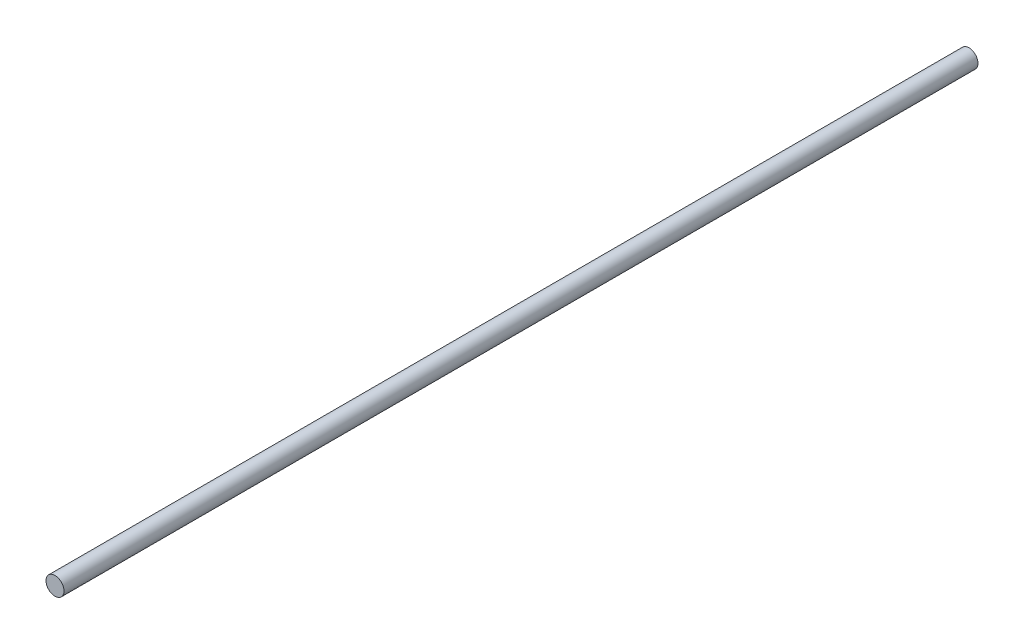
from build123d import *

# Parameters (mm, degrees)
SKETCH2_W = 405.8
SKETCH2_H = 4


with BuildPart() as part:
    # Sketch2 → Revolve1 (revolve)
    with BuildSketch(Plane(origin=(0, 0, 0), x_dir=(0, 0, -1), z_dir=(1, 0, 0)), mode=Mode.PRIVATE) as revolve1_sk:
        with Locations((130, 2)):
            Rectangle(SKETCH2_W, SKETCH2_H)
    revolve(revolve1_sk.sketch.rotate(Axis((0, 0, 72.9), (0, 0, -1)), 90), axis=Axis((0, 0, 72.9), (0, 0, -1)))


solid = part.part
